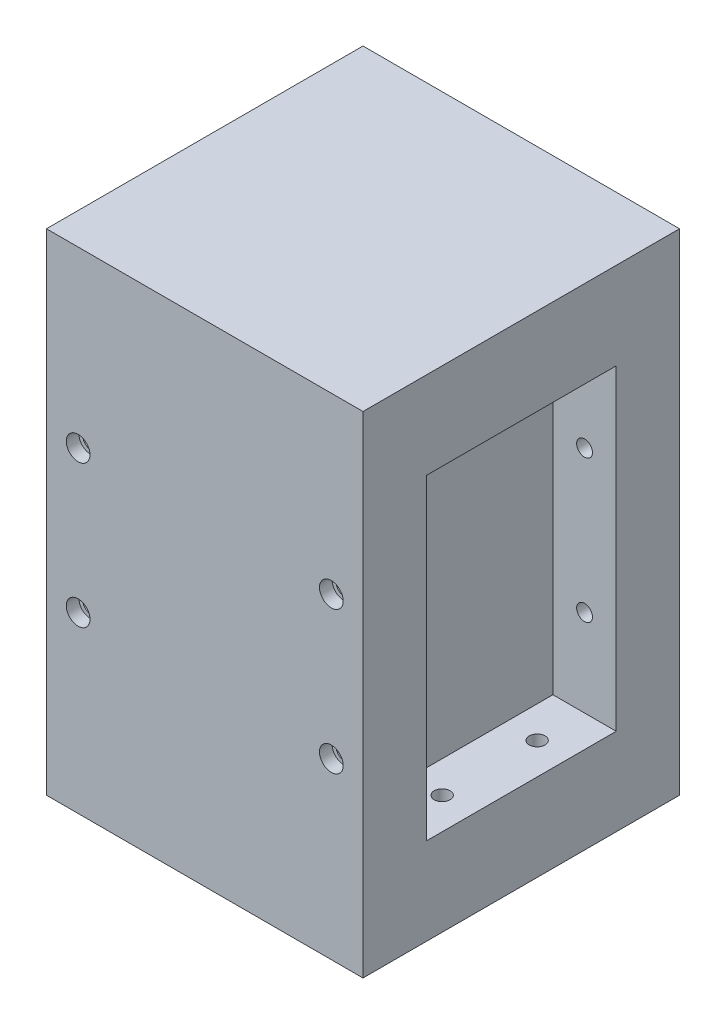
from build123d import *

# Parameters (mm, degrees)
SKETCH1_W           = 100
SKETCH1_H           = 100
BOSS_EXTRUDE1_DEPTH = 155
SKETCH2_W           = 60
SKETCH2_H           = 100
CUT_EXTRUDE1_DEPTH  = 20
SKETCH3_R           = 3.75
CUT_EXTRUDE2_DEPTH  = 4
SKETCH4_R           = 2.5
CUT_EXTRUDE3_DEPTH  = 192.115148536
SKETCH6_R           = 3.75
CUT_EXTRUDE5_DEPTH  = 4
SKETCH9_R           = 2.5
CUT_EXTRUDE7_DEPTH  = 50


with BuildPart() as part:
    # Sketch1 → Boss-Extrude1 (new body)
    with BuildSketch(Plane(origin=(0, 0, 0), x_dir=(1, 0, 0), z_dir=(0, 1, 0))):
        Rectangle(SKETCH1_W, SKETCH1_H)
    extrude(amount=BOSS_EXTRUDE1_DEPTH)

    # Sketch2 → Cut-Extrude1 (cut)
    with BuildSketch(Plane.ZY.offset(50)):
        with Locations((0, 77.5)):
            Rectangle(SKETCH2_W, SKETCH2_H)
    cut_extrude1 = extrude(amount=-CUT_EXTRUDE1_DEPTH, mode=Mode.SUBTRACT)

    # Mirror1: Cut-Extrude1 across plane
    add(cut_extrude1.mirror(Plane(origin=(0, 0, 0), x_dir=(0, 0, 1), z_dir=(1, 0, 0))), mode=Mode.SUBTRACT)

    # Sketch3 → Cut-Extrude2 (cut)
    with BuildSketch(Plane.XY.offset(50)):
        with Locations((-40, 100)):
            Circle(SKETCH3_R)
        with Locations(Location((-40, 55, 0), (0, 0, 180))):
            Circle(SKETCH3_R)
        with Locations((40, 55)):
            Circle(SKETCH3_R)
        with Locations(Location((40, 100, 0), (0, 0, 180))):
            Circle(SKETCH3_R)
    cut_extrude2 = extrude(amount=-CUT_EXTRUDE2_DEPTH, mode=Mode.SUBTRACT)

    # Mirror2: Cut-Extrude2 across plane
    add(cut_extrude2.mirror(Plane.XY), mode=Mode.SUBTRACT)

    # Sketch4 → Cut-Extrude3 (cut, through all)
    with BuildSketch(Plane.XY.offset(50)):
        with Locations(Location((-40, 100, 0), (0, 0, 180))):
            Circle(SKETCH4_R)
        with Locations((40, 100)):
            Circle(SKETCH4_R)
        with Locations((40, 55)):
            Circle(SKETCH4_R)
        with Locations((-40, 55)):
            Circle(SKETCH4_R)
    extrude(amount=-CUT_EXTRUDE3_DEPTH, mode=Mode.SUBTRACT)

    # Sketch6 → Cut-Extrude5 (cut)
    with BuildSketch(Plane.XZ):
        with Locations(Location((-40, 15, 0), (0, 0, 270))):
            Circle(SKETCH6_R)
        with Locations(Location((40, 15, 0), (0, 0, 90))):
            Circle(SKETCH6_R)
        with Locations(Location((40, -15, 0), (0, 0, 270))):
            Circle(SKETCH6_R)
        with Locations(Location((-40, -15, 0), (0, 0, 90))):
            Circle(SKETCH6_R)
    extrude(amount=-CUT_EXTRUDE5_DEPTH, mode=Mode.SUBTRACT)

    # Sketch9 → Cut-Extrude7 (cut)
    with BuildSketch(Plane.XZ):
        with Locations(Location((-40, 15, 0), (0, 0, 270))):
            Circle(SKETCH9_R)
        with Locations(Location((40, 15, 0), (0, 0, 90))):
            Circle(SKETCH9_R)
        with Locations(Location((40, -15, 0), (0, 0, 270))):
            Circle(SKETCH9_R)
        with Locations(Location((-40, -15, 0), (0, 0, 270))):
            Circle(SKETCH9_R)
    extrude(amount=-CUT_EXTRUDE7_DEPTH, mode=Mode.SUBTRACT)


solid = part.part
